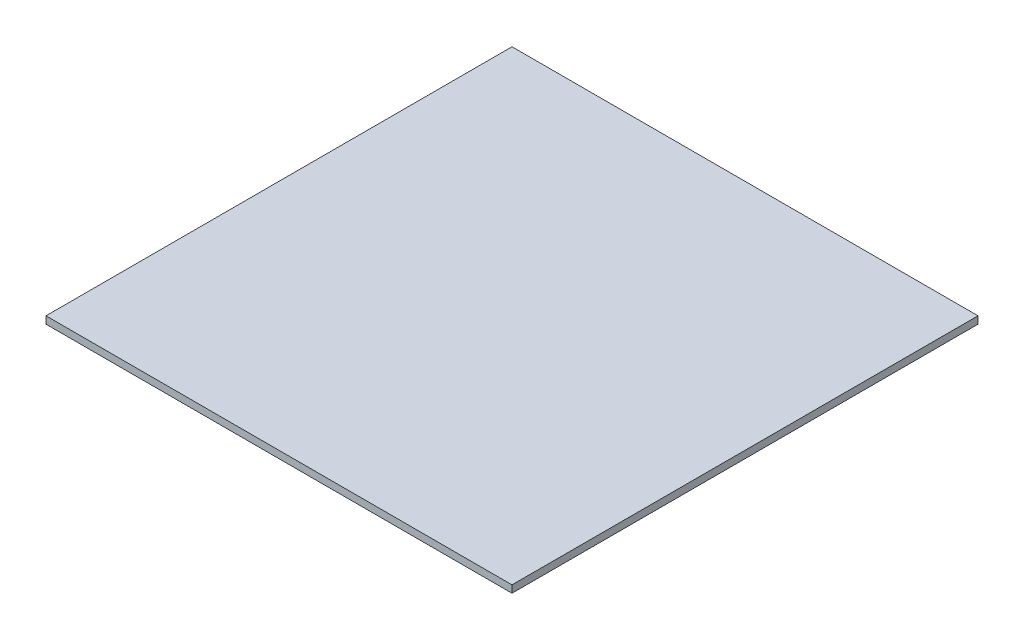
from build123d import *

# Parameters (mm, degrees)
SKETCH1_W           = 609.6
SKETCH1_H           = 609.6
BOSS_EXTRUDE1_DEPTH = 9.525


with BuildPart() as part:
    # Sketch1 → Boss-Extrude1 (new body)
    with BuildSketch(Plane(origin=(0, 0, 0), x_dir=(1, 0, 0), z_dir=(0, 1, 0))):
        Rectangle(SKETCH1_W, SKETCH1_H)
    extrude(amount=BOSS_EXTRUDE1_DEPTH)


solid = part.part
